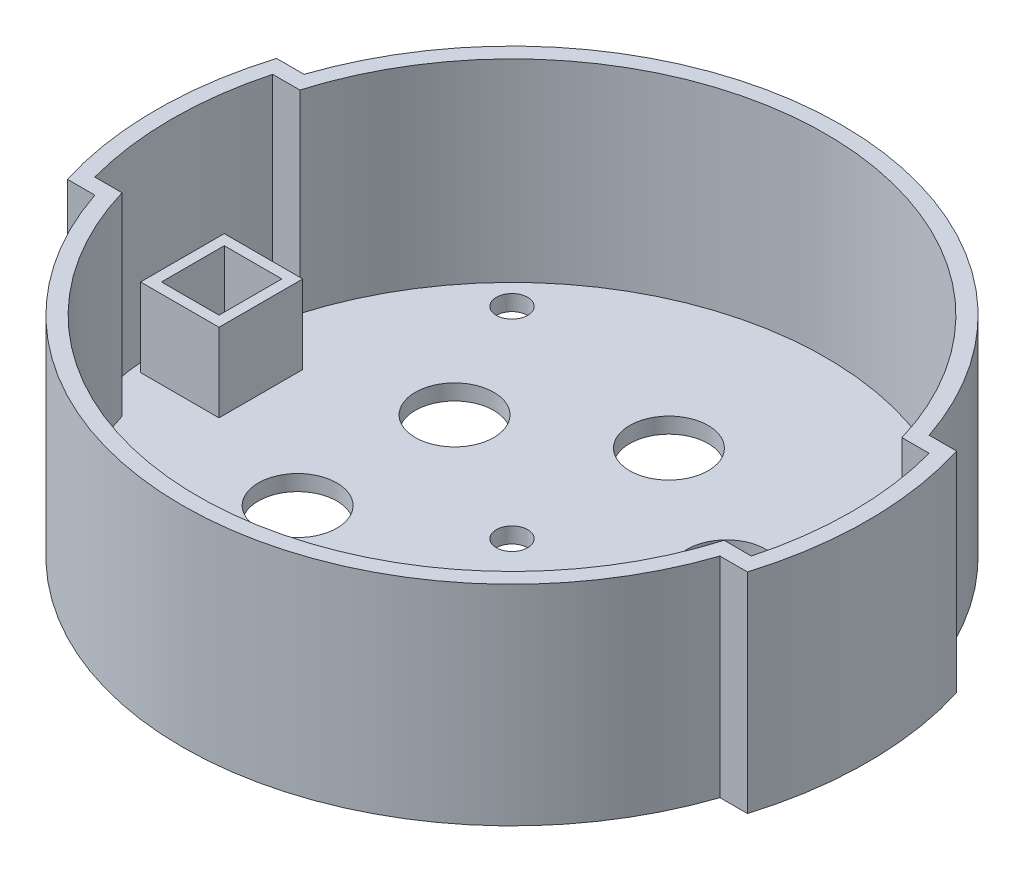
from build123d import *

# Parameters (mm, degrees)
SKETCH1_R               = 68
BOSS_EXTRUDE1_DEPTH     = 40
CUT_EXTRUDE1_START      = -40
CUT_EXTRUDE1_DEPTH      = 40
SHELL1_T                = -3
CUT_EXTRUDE2_DEPTH      = 101.960388272
CUT_EXTRUDE2_DEPTH_BACK = 101.960388272
SKETCH3_R               = 3
SKETCH3_R_2             = 7.5
SKETCH4_R               = 3
CUT_EXTRUDE3_DEPTH      = 3
SKETCH6_W               = 15
SKETCH6_H               = 16
SKETCH6_W_2             = 11
SKETCH6_H_2             = 12
BOSS_EXTRUDE2_DEPTH     = 15
SKETCH7_W               = 4
SKETCH7_H               = 2.5
CUT_EXTRUDE5_DEPTH      = 3


with BuildPart() as part:
    # Sketch1 → Boss-Extrude1 (new body)
    with BuildSketch(Plane(origin=(0, 0, 0), x_dir=(1, 0, 0), z_dir=(0, 1, 0))):
        with Locations(Location((0, 0, 0), (0, 0, 270))):
            Circle(SKETCH1_R)
    extrude(amount=BOSS_EXTRUDE1_DEPTH)

    # Sketch2 → Cut-Extrude1 (cut)
    with BuildSketch(Plane(origin=(0, 40, 0), x_dir=(1, 0, 0), z_dir=(0, 1, 0)).offset(CUT_EXTRUDE1_START)):
        with BuildLine():
            Line((-59.741108125, -20), (-64.992307237, -20))
            ThreePointArc((-64.992307237, -20), (0, -68), (64.992307237, -20))
            Line((64.992307237, -20), (59.741108125, -20))
            ThreePointArc((59.741108125, -20), (0, -63), (-59.741108125, -20))
        make_face()
        with BuildLine():
            Line((-59.741108125, 20), (-64.992307237, 20))
            ThreePointArc((-64.992307237, 20), (0, 68), (64.992307237, 20))
            Line((64.992307237, 20), (59.741108125, 20))
            ThreePointArc((59.741108125, 20), (0, 63), (-59.741108125, 20))
        make_face()
    extrude(amount=CUT_EXTRUDE1_DEPTH, mode=Mode.SUBTRACT)

    # Shell1
    shell1_openings = [part.faces().sort_by_distance(p)[0] for p in [
        (0, 40, 0),
    ]]
    offset(amount=SHELL1_T, openings=shell1_openings, kind=Kind.INTERSECTION)

    # Sketch3 → Cut-Extrude2 (cut, two sides: drawn at the far end of the back side and taken through both)
    with BuildSketch(Plane.XZ.offset(-CUT_EXTRUDE2_DEPTH_BACK)):
        with Locations(Location((-38.466608897, 38.466608897, 0), (0, 0, 90))):
            Circle(SKETCH3_R)
        with Locations(Location((38.466608897, -38.466608897, 0), (0, 0, 90))):
            Circle(SKETCH3_R)
        with Locations(Location((0, 30, 0), (0, 0, 90))):
            Circle(SKETCH3_R_2)
        with Locations(Location((25.980762114, 15, 0), (0, 0, 90))):
            Circle(SKETCH3_R_2)
        with Locations(Location((25.980762114, -15, 0), (0, 0, 90))):
            Circle(SKETCH3_R_2)
        with Locations(Location((0, -30, 0), (0, 0, 90))):
            Circle(SKETCH3_R_2)
        with Locations(Location((-25.980762114, -15, 0), (0, 0, 90))):
            Circle(SKETCH3_R_2)
        with Locations(Location((-25.980762114, 15, 0), (0, 0, 90))):
            Circle(SKETCH3_R_2)
        with Locations(Location((-38.466608897, -38.466608897, 0), (0, 0, 90))):
            Circle(SKETCH3_R)
        with Locations(Location((38.466608897, 38.466608897, 0), (0, 0, 90))):
            Circle(SKETCH3_R)
    extrude(amount=CUT_EXTRUDE2_DEPTH + CUT_EXTRUDE2_DEPTH_BACK, mode=Mode.SUBTRACT)

    # Sketch4 → Cut-Extrude3 (cut)
    with BuildSketch(Plane(origin=(0, 3, 0), x_dir=(1, 0, 0), z_dir=(0, 1, 0))):
        with Locations(Location((0, 0, 0), (0, 0, 270))):
            Circle(SKETCH4_R)
    extrude(amount=-CUT_EXTRUDE3_DEPTH, mode=Mode.SUBTRACT)

    # Sketch6 → Boss-Extrude2 (add)
    with BuildSketch(Plane(origin=(0, 3, 0), x_dir=(1, 0, 0), z_dir=(0, 1, 0))):
        with Locations((-55.5, 0)):
            Rectangle(SKETCH6_W, SKETCH6_H)
        with Locations((-55.5, 0)):
            Rectangle(SKETCH6_W_2, SKETCH6_H_2, mode=Mode.SUBTRACT)
    extrude(amount=BOSS_EXTRUDE2_DEPTH)

    # Sketch7 → Cut-Extrude5 (cut)
    with BuildSketch(Plane(origin=(0, 3, 0), x_dir=(1, 0, 0), z_dir=(0, 1, 0))):
        with Locations((-55.5, -4.75)):
            Rectangle(SKETCH7_W, SKETCH7_H)
    extrude(amount=-CUT_EXTRUDE5_DEPTH, mode=Mode.SUBTRACT)


solid = part.part
